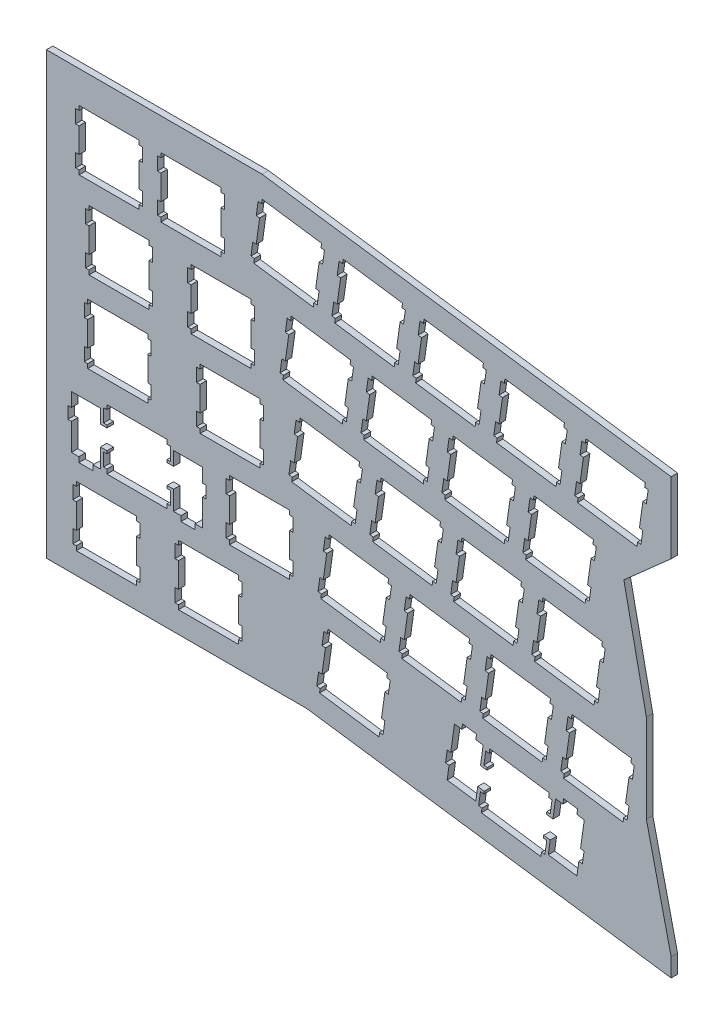
from build123d import *

# Parameters (mm, degrees)
BOSS_EXTRUDE1_DEPTH = 1.5
CUT_EXTRUDE2_DEPTH  = 171.234987081


with BuildPart() as part:
    # Sketch1 → Boss-Extrude1 (new body)
    with BuildSketch(Plane.XY):
        Polygon((139.439489186, -12.637598287), (133.662572146, 12.254996796), (133.662572146, 32.882214141), (128.42436586, 57.92400032), (139.439489186, 67.680194754), (139.439489186, 84.248821017), (44.112378731, 97.643892189), (-6.156128155, 97.643892189), (-6.156128155, -5), (54.537677644, -5), (139.439489186, -16.925240923), align=None)
    extrude(amount=BOSS_EXTRUDE1_DEPTH)

    # Sketch2 → Cut-Extrude2 (cut, through all)
    with BuildSketch(Plane.XY):
        Polygon((17.465534642, 52.096162596), (3.466904557, 52.096162596), (3.466904557, 51.097124679), (2.666254311, 51.097124679), (2.666254311, 47.996817341), (3.466904557, 47.996817341), (3.466904557, 42.197077753), (2.666254311, 42.197077753), (2.666254311, 39.098170328), (3.466904557, 39.098170328), (3.466904557, 38.097732498), (17.465534642, 38.097732498), (17.465534642, 39.098170328), (18.264784974, 39.098170328), (18.264784974, 42.197077753), (17.465534642, 42.197077753), (17.465534642, 47.996817341), (18.264784974, 47.996817341), (18.264784974, 51.097124679), (17.465534642, 51.097124679), align=None)
        Polygon((123.271559553, 41.988990684), (123.410550916, 42.979829111), (109.548412349, 44.926708126), (109.409420986, 43.937569594), (108.615470324, 44.047662752), (108.184497106, 40.979053445), (108.976447892, 40.867260392), (108.170497976, 35.125417206), (107.37854719, 35.235810346), (106.945574096, 32.16540115), (107.739524758, 32.055407985), (107.59853352, 31.064469565), (121.462671963, 29.116190637), (121.601663325, 30.105729144), (122.393614111, 29.995336004), (122.825587267, 33.065345225), (122.032636543, 33.175738365), (122.840586335, 38.918981463), (123.632537121, 38.807488392), (124.063510339, 41.877497613), align=None)
        Polygon((50.787163941, 43.189016111), (50.355790747, 40.11900689), (51.148041515, 40.009013726), (51.009050152, 39.018075305), (64.871388707, 37.069796377), (65.010280075, 38.058934909), (65.80403075, 37.948841751), (66.23400403, 41.018950965), (65.443153175, 41.129344105), (66.249203085, 46.872587204), (67.041453853, 46.760694157), (67.474326953, 49.831103353), (66.682076185, 49.941196511), (66.821067548, 50.933434851), (52.95732908, 52.880313866), (52.818337718, 51.890875353), (52.02608695, 52.001268493), (51.59321385, 48.932659185), (52.386964524, 48.820766138), (51.578114789, 43.077623033), align=None)
        Polygon((103.529786363, 32.646571249), (103.960759581, 35.715180557), (103.168808795, 35.826673628), (103.975758649, 41.570316702), (104.769709311, 41.459823568), (105.199682591, 44.528432876), (104.408731743, 44.640325923), (104.546723168, 45.629464455), (90.684284619, 47.578043364), (90.545293257, 46.588604851), (89.752942496, 46.700397904), (89.321569302, 43.629988708), (90.11382007, 43.518495636), (89.306370247, 37.775352532), (88.51411948, 37.886745609), (88.082646293, 34.816736389), (88.875297035, 34.705243317), (88.736005691, 33.715804804), (102.599844153, 31.767525875), (102.738835515, 32.75806432), align=None)
        Polygon((96.895198656, 23.330350185), (96.087248864, 17.586807106), (95.295298078, 17.698500165), (94.863324922, 14.62839095), (95.656275646, 14.516797885), (95.517284283, 13.527459365), (109.380422788, 11.577580536), (109.518414213, 12.568418963), (110.310364999, 12.456725903), (110.742338155, 15.526835118), (109.949387431, 15.638428183), (110.757337223, 21.381771276), (111.549288009, 21.270078217), (111.981261164, 24.338887512), (111.188310441, 24.451680503), (111.327301803, 25.44121901), (97.465163236, 27.389497938), (97.326171874, 26.398959493), (96.534221088, 26.510452565), (96.101247994, 23.441743263), align=None)
        Polygon((15.598450668, 12.999692162), (14.799200335, 12.999692162), (14.799200335, 13.998630085), (0.799200335, 13.998630085), (0.799200335, 12.999692162), (0, 12.999692162), (0, 9.89928483), (0.799200335, 9.89928483), (0.799200335, 4.099445249), (0, 4.099445249), (0, 1.00043783), (0.799200335, 1.00043783), (0.799200335, 0), (14.799200335, 0), (14.799200335, 1.00043783), (15.598450668, 1.00043783), (15.598450668, 4.099445249), (14.799200335, 4.099445249), (14.799200335, 9.89928483), (15.598450668, 9.89928483), align=None)
        Polygon((93.754393834, 71.48255787), (93.892385259, 72.471996383), (94.684336045, 72.362003218), (95.116309201, 75.432012439), (94.323358477, 75.542105598), (95.131308269, 81.285648678), (95.923259055, 81.173855625), (96.355232211, 84.243864846), (95.562281487, 84.354257985), (95.701272849, 85.346196344), (81.837834363, 87.29337534), (81.700242913, 86.303936827), (80.907992146, 86.414329967), (80.475119046, 83.344020764), (81.26886972, 83.233927606), (80.461419897, 77.490684507), (79.669069136, 77.602177579), (79.237695943, 74.532168358), (80.02994671, 74.4220752), (79.890955348, 73.429736866), align=None)
        Polygon((99.771019944, 83.764494635), (99.339046788, 80.69438542), (100.131997512, 80.582592367), (99.32404772, 74.839349269), (98.533096872, 74.951242316), (98.100123778, 71.88083312), (98.893074502, 71.769340048), (98.753083201, 70.779901535), (112.617221644, 68.831622606), (112.755213069, 69.822161051), (113.549163731, 69.71066798), (113.980136949, 72.779277288), (113.187186225, 72.891070341), (113.995136017, 78.634313439), (114.786086865, 78.523920299), (115.219059958, 81.592929582), (114.425109297, 81.70432266), (114.566100535, 82.693861167), (100.701962092, 84.642140096), (100.56297073, 83.652601588), align=None)
        Polygon((90.516295059, 14.228815781), (90.655286421, 15.219554213), (91.446537251, 15.107961148), (91.879510345, 18.177970369), (91.086559621, 18.288263515), (91.894509413, 24.03300652), (92.686460199, 23.921213467), (93.116433479, 26.990122757), (92.325482631, 27.101615828), (92.463474056, 28.092554248), (78.601335488, 30.040833177), (78.461944151, 29.049894757), (77.669693383, 29.161687809), (77.238220196, 26.093078502), (78.030570957, 25.979885536), (77.224521048, 20.23804235), (76.432170287, 20.348235503), (75.999697162, 17.279526201), (76.792047923, 17.167933136), (76.652656585, 16.178594616), align=None)
        Polygon((23.811040314, 9.89928483), (24.611590565, 9.89928483), (24.611590565, 4.099445249), (23.811040314, 4.099445249), (23.811040314, 1.00043783), (24.611590565, 1.00043783), (24.611590565, 0), (38.610120657, 0), (38.610120657, 1.00043783), (39.410870896, 1.00043783), (39.410870896, 4.099445249), (38.610120657, 4.099445249), (38.610120657, 9.89928483), (39.410870896, 9.89928483), (39.410870896, 12.999692162), (38.610120657, 12.999692162), (38.610120657, 13.998630085), (24.611590565, 13.998630085), (24.611590565, 12.999692162), (23.811040314, 12.999692162), align=None)
        Polygon((0.666918556, 77.195802832), (1.466128891, 77.195802832), (1.466128891, 76.195365002), (15.466158889, 76.195365002), (15.466158889, 77.195802832), (16.265309227, 77.195802832), (16.265309227, 80.29611017), (15.466158889, 80.29611017), (15.466158889, 86.094449845), (16.265309227, 86.094449845), (16.265309227, 89.195257152), (15.466158889, 89.195257152), (15.466158889, 90.194195075), (1.466128891, 90.194195075), (1.466128891, 89.195257152), (0.666918556, 89.195257152), (0.666918556, 86.094449845), (1.466128891, 86.094449845), (1.466128891, 80.29611017), (0.666918556, 80.29611017), align=None)
        Polygon((26.763856817, 58.14698658), (27.564607057, 58.14698658), (27.564607057, 57.14654875), (41.563037154, 57.14654875), (41.563037154, 58.14698658), (42.36238748, 58.14698658), (42.36238748, 61.247293918), (41.563037154, 61.247293918), (41.563037154, 67.045633593), (42.36238748, 67.045633593), (42.36238748, 70.145940931), (41.563037154, 70.145940931), (41.563037154, 71.144978848), (27.564607057, 71.144978848), (27.564607057, 70.145940931), (26.763856817, 70.145940931), (26.763856817, 67.045633593), (27.564607057, 67.045633593), (27.564607057, 61.247293918), (26.763856817, 61.247293918), align=None)
        Polygon((69.185520614, 65.695217511), (68.378070791, 59.95347432), (67.587219937, 60.063467485), (67.154346837, 56.994858177), (67.946697598, 56.883365105), (67.807706235, 55.892526679), (81.671344709, 53.94424775), (81.808936159, 54.934786195), (82.601186926, 54.823293124), (83.034060026, 57.893302345), (82.241709265, 58.004795416), (83.049159088, 63.748338496), (83.840109936, 63.636545443), (84.271483129, 66.705554726), (83.479232362, 66.817047798), (83.618223725, 67.807886224), (69.755985164, 69.756165153), (69.616993801, 68.765226732), (68.82464304, 68.877119779), (68.393269847, 65.807110558), align=None)
        Polygon((102.704837628, 60.98561018), (103.135810846, 64.055619401), (102.342860122, 64.165712559), (102.482851423, 65.156550986), (88.618912968, 67.104829914), (88.47952163, 66.114291469), (87.688670775, 66.225784541), (87.256197651, 63.15577532), (88.049848331, 63.045682161), (87.240998595, 57.300739168), (86.450147741, 57.413932134), (86.018674554, 54.343922913), (86.811025315, 54.232129861), (86.671633977, 53.241591415), (100.533972532, 51.294312425), (100.672963894, 52.283850932), (101.465914618, 52.171957885), (101.896887836, 55.2420671), (101.10493705, 55.353860153), (101.911886904, 61.095703338), align=None)
        Polygon((106.551598579, 63.574849277), (106.120625361, 60.504440081), (106.912576147, 60.394346923), (106.104626355, 54.651203818), (105.312675569, 54.761196983), (104.881702351, 51.692587675), (105.673653137, 51.581094603), (105.534661775, 50.590256177), (119.396800342, 48.641577273), (119.535791704, 49.632515694), (120.329742366, 49.521022622), (120.759715646, 52.591031843), (119.968764798, 52.702524915), (120.774714714, 58.445768013), (121.5666655, 58.334274941), (121.999638594, 61.404284162), (121.205687932, 61.514777296), (121.346679171, 62.505315741), (107.483540666, 64.453894651), (107.343549365, 63.462956231), align=None)
        Polygon((84.305681004, 38.478008867), (85.113530802, 44.221251965), (85.905781569, 44.109758894), (86.336854781, 47.179768114), (85.544604014, 47.291261186), (85.683895358, 48.280699699), (71.821656797, 50.228978628), (71.68096554, 49.238440183), (70.888614779, 49.351333167), (70.459041474, 46.282723859), (71.249892328, 46.169830875), (70.443842418, 40.426287795), (69.651191676, 40.538080848), (69.220118464, 37.468071627), (70.010969318, 37.356278574), (69.871677974, 36.367140042), (83.735316448, 34.418461138), (83.874607792, 35.409399559), (84.666958553, 35.296106599), (85.098331747, 38.366515795), align=None)
        Polygon((35.716400481, 20.049254082), (36.51715072, 20.049254082), (36.51715072, 19.048816252), (50.515580817, 19.048816252), (50.515580817, 20.049254082), (51.314931144, 20.049254082), (51.314931144, 23.148261501), (50.515580817, 23.148261501), (50.515580817, 28.948001089), (51.314931144, 28.948001089), (51.314931144, 32.048308427), (50.515580817, 32.048308427), (50.515580817, 33.047346343), (36.51715072, 33.047346343), (36.51715072, 32.048308427), (35.716400481, 32.048308427), (35.716400481, 28.948001089), (36.51715072, 28.948001089), (36.51715072, 23.148261501), (35.716400481, 23.148261501), align=None)
        Polygon((72.583609447, 17.760496312), (73.015082634, 20.829205614), (72.222731873, 20.940798679), (73.03028169, 26.682541871), (73.822532457, 26.572448712), (74.253605669, 29.642557927), (73.462754815, 29.752951067), (73.600646246, 30.743489512), (59.738407685, 32.692068421), (59.599016347, 31.701229995), (58.80676558, 31.812723066), (58.375692368, 28.742613852), (59.166543222, 28.632620687), (58.360493312, 22.889377589), (57.568242545, 22.999470747), (57.136769358, 19.930761446), (57.929120119, 19.81916838), (57.789728781, 18.828329954), (71.651967342, 16.881350945), (71.792758593, 17.870689464), align=None)
        Polygon((114.156126012, 15.04726492), (113.726152732, 11.977255699), (114.520103394, 11.865662634), (114.379112155, 10.874824207), (128.243250598, 8.927745204), (128.381242023, 9.917183718), (129.175192684, 9.806890572), (129.606165903, 12.875599873), (128.813215179, 12.987292933), (129.62116497, 18.729136118), (130.412115819, 18.618942966), (130.845088912, 21.68905218), (130.051138251, 21.799245333), (130.192129489, 22.789883772), (116.327991046, 24.738562675), (116.188999684, 23.749024168), (115.394049084, 23.859417308), (114.965075742, 20.789208099), (115.758026465, 20.679014947), (114.950076674, 14.935671855), align=None)
        Polygon((73.167773146, 10.557943899), (73.308564396, 11.548682332), (59.444925922, 13.497061254), (59.305534585, 12.506322821), (58.513283817, 12.61801588), (58.082210605, 9.547906666), (58.874461373, 9.437713514), (58.06701155, 3.694370421), (57.274760783, 3.804563574), (56.843287596, 0.735854272), (57.635638357, 0.624261207), (57.496247019, -0.366477226), (71.35848558, -2.313556229), (71.497876918, -1.324217709), (72.291527598, -1.435810775), (72.723000785, 1.63429844), (71.930350043, 1.745891505), (72.736699934, 7.487834685), (73.529050695, 7.377641532), (73.96152382, 10.447650753), align=None)
        Polygon((2.952936496, 61.247293918), (2.952936496, 58.14698658), (3.752186828, 58.14698658), (3.752186828, 57.14654875), (17.752116833, 57.14654875), (17.752116833, 58.14698658), (18.551367165, 58.14698658), (18.551367165, 61.247293918), (17.752116833, 61.247293918), (17.752116833, 67.045633593), (18.551367165, 67.045633593), (18.551367165, 70.145940931), (17.752116833, 70.145940931), (17.752116833, 71.144978848), (3.752186828, 71.144978848), (3.752186828, 70.145940931), (2.952936496, 70.145940931), (2.952936496, 67.045633593), (3.752186828, 67.045633593), (3.752186828, 61.247293918), align=None)
        Polygon((50.321592872, 68.34655275), (49.51414305, 62.604709564), (48.72289222, 62.714802723), (48.291819008, 59.644793502), (49.084069776, 59.534400362), (48.944778432, 58.543861917), (62.807016993, 56.595183014), (62.946308337, 57.586121434), (63.738659098, 57.474628362), (64.169732309, 60.544637583), (63.377381548, 60.654730742), (64.184831371, 66.399373753), (64.977182132, 66.287880682), (65.408555325, 69.35648999), (64.616304558, 69.468283042), (64.755595902, 70.458821488), (50.891957428, 72.406100478), (50.754065997, 71.416561971), (49.961715236, 71.528055042), (49.529242111, 68.458045821), align=None)
        Polygon((75.029657443, 75.123331622), (75.820508297, 75.011538569), (76.252981422, 78.081947765), (75.460730655, 78.193340842), (76.268180477, 83.936583941), (77.060431245, 83.826490782), (77.490504519, 86.895400072), (76.699553671, 87.006393174), (76.837545095, 87.996331657), (62.975306535, 89.94421061), (62.835915197, 88.954272127), (62.043664429, 89.06526523), (61.612191242, 85.996655922), (62.404841985, 85.885262844), (61.597092181, 80.141619771), (60.806141333, 80.253512817), (60.373668208, 77.183403603), (61.166018969, 77.07161055), (61.026627631, 76.082472018), (74.890266105, 74.133893108), align=None)
        Polygon((23.46786164, 19.279001948), (25.191654519, 19.279001948), (25.191654519, 18.078776533), (28.491949429, 18.078776533), (28.491949429, 19.279001948), (30.216942233, 19.279001948), (30.216942233, 25.548812324), (31.040991024, 25.548812324), (31.040991024, 28.348638335), (30.216942233, 28.348638335), (30.216942233, 31.578437626), (23.46786164, 31.578437626), (23.46786164, 28.348638335), (21.942456433, 28.348638335), (21.942456433, 28.948001089), (22.741706765, 28.948001089), (22.741706765, 32.048308427), (21.942456433, 32.048308427), (21.942456433, 33.047346343), (7.943926342, 33.047346343), (7.943926342, 32.048308427), (7.143276096, 32.048308427), (7.143276096, 28.948001089), (7.943926342, 28.948001089), (7.943926342, 28.348638335), (6.418521135, 28.348638335), (6.418521135, 31.578437626), (-0.330709449, 31.578437626), (-0.330709449, 28.348638335), (-1.156128155, 28.348638335), (-1.156128155, 25.548812324), (-0.330709449, 25.548812324), (-0.330709449, 19.279001948), (1.393133427, 19.279001948), (1.393133427, 18.078776533), (4.693228349, 18.078776533), (4.693228349, 19.279001948), (6.418521135, 19.279001948), (6.418521135, 23.749024168), (7.943926342, 23.749024168), (7.943926342, 23.148261501), (7.143276096, 23.148261501), (7.143276096, 20.049254082), (7.943926342, 20.049254082), (7.943926342, 19.048816252), (21.942456433, 19.048816252), (21.942456433, 20.049254082), (22.741706765, 20.049254082), (22.741706765, 23.148261501), (21.942456433, 23.148261501), (21.942456433, 23.749024168), (23.46786164, 23.749024168), align=None)
        Polygon((119.42579854, 81.001666325), (118.634847692, 81.113159397), (118.203874474, 78.043150176), (118.995825259, 77.931657104), (118.187875468, 72.188014031), (117.395924682, 72.299907077), (116.964951464, 69.231297769), (117.75690225, 69.11800481), (117.617910887, 68.128866278), (131.480049454, 66.180287368), (131.619040817, 67.171125794), (132.411991541, 67.059332741), (132.842964759, 70.128342024), (132.051013973, 70.241235009), (132.857963827, 75.982978201), (133.649914612, 75.872985036), (134.081887768, 78.941594344), (133.288937045, 79.053087415), (133.427928407, 80.042525929), (119.564789902, 81.99220477), align=None)
        Polygon((58.196503503, 86.476126126), (58.627576715, 89.546235341), (57.836725861, 89.658228382), (57.974617292, 90.647166926), (44.112378731, 92.596045817), (43.973387368, 91.605107397), (43.180736626, 91.718100375), (42.749663414, 88.648291142), (43.540514268, 88.536298101), (42.734464358, 82.792955009), (41.942213591, 82.903048168), (41.510840398, 79.83443886), (42.303091165, 79.722945788), (42.164099802, 78.733407281), (56.025938388, 76.78372844), (56.166729639, 77.775766792), (56.957580493, 77.662873807), (57.38905368, 80.732883028), (56.596702919, 80.844676081), (57.404252736, 86.58741921), align=None)
        Polygon((35.314325467, 86.094449845), (35.314325467, 89.195257152), (34.514975141, 89.195257152), (34.514975141, 90.194195075), (20.514945143, 90.194195075), (20.514945143, 89.195257152), (19.71569481, 89.195257152), (19.71569481, 86.094449845), (20.514945143, 86.094449845), (20.514945143, 80.29611017), (19.71569481, 80.29611017), (19.71569481, 77.195802832), (20.514945143, 77.195802832), (20.514945143, 76.195365002), (34.514975141, 76.195365002), (34.514975141, 77.195802832), (35.314325467, 77.195802832), (35.314325467, 80.29611017), (34.514975141, 80.29611017), (34.514975141, 86.094449845), align=None)
        Polygon((112.512228169, 5.806739153), (111.891266757, 1.379414279), (110.379360711, 1.591601093), (110.463355491, 2.186864102), (111.256306215, 2.075271037), (111.687279433, 5.145380251), (110.896328585, 5.256973317), (111.035319948, 6.246311836), (97.172181443, 8.194690759), (97.03319008, 7.203952326), (96.240239357, 7.315545391), (95.809266138, 4.24553617), (96.601216924, 4.135243024), (96.517222144, 3.541379929), (95.008315912, 3.752266823), (95.630277261, 8.179591697), (93.921383457, 8.419376796), (94.089373018, 9.607102987), (90.820776137, 10.065974472), (90.654286484, 8.878148286), (88.946892586, 9.117933386), (88.073146883, 2.910319144), (87.256197651, 3.024712036), (86.866021897, 0.252184329), (87.683371105, 0.136491518), (87.233899036, -3.060409817), (93.918383643, -4.00014142), (94.367355743, -0.801950165), (95.876261975, -1.014136979), (95.794267071, -1.608000074), (95.001316347, -1.496407009), (94.570343129, -4.566496225), (95.362293915, -4.678109289), (95.223302552, -5.668857721), (109.085441119, -7.615896726), (109.226432357, -6.626518209), (110.018383143, -6.738131273), (110.448356424, -3.668062056), (109.657405576, -3.556448992), (109.740400418, -2.962515901), (111.250306588, -3.174802709), (110.801334488, -6.372993964), (117.483919214, -7.312735566), (117.934891189, -4.113134398), (118.751840421, -4.228877205), (119.141816187, -1.456409495), (118.324866955, -1.342016603), (119.195812832, 4.866997551), (117.487918965, 5.10678265), (117.654908588, 6.295908754), (114.388111596, 6.754780239), (114.221121973, 5.566954054), align=None)
        Polygon((44.458457224, 51.097124679), (43.657706985, 51.097124679), (43.657706985, 52.096162596), (29.658876913, 52.096162596), (29.658876913, 51.097124679), (28.858526649, 51.097124679), (28.858526649, 47.996817341), (29.658876913, 47.996817341), (29.658876913, 42.197077753), (28.858526649, 42.197077753), (28.858526649, 39.098170328), (29.658876913, 39.098170328), (29.658876913, 38.097732498), (43.657706985, 38.097732498), (43.657706985, 39.098170328), (44.458457224, 39.098170328), (44.458457224, 42.197077753), (43.657706985, 42.197077753), (43.657706985, 47.996817341), (44.458457224, 47.996817341), align=None)
    extrude(amount=CUT_EXTRUDE2_DEPTH, mode=Mode.SUBTRACT)


solid = part.part
